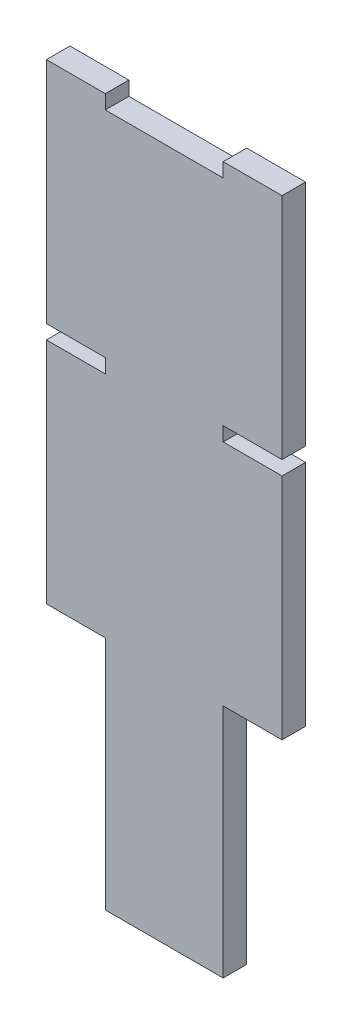
from build123d import *

# Parameters (mm, degrees)
SKETCH2_W           = 50
SKETCH2_H           = 150
BOSS_EXTRUDE1_DEPTH = 5
SKETCH3_W           = 25
SKETCH3_H           = 3
SKETCH3_W_2         = 12.5
SKETCH3_H_2         = 50
CUT_EXTRUDE1_DEPTH  = 5


with BuildPart() as part:
    # Sketch2 → Boss-Extrude1 (new body)
    with BuildSketch(Plane.XY):
        Rectangle(SKETCH2_W, SKETCH2_H)
    extrude(amount=BOSS_EXTRUDE1_DEPTH)

    # Sketch3 → Cut-Extrude1 (cut)
    with BuildSketch(Plane.XY.offset(5)):
        with Locations((0, 73.5)):
            Rectangle(SKETCH3_W, SKETCH3_H)
        with Locations((-18.75, 25)):
            Rectangle(SKETCH3_W_2, SKETCH3_H)
        with Locations((18.75, 25)):
            Rectangle(SKETCH3_W_2, SKETCH3_H)
        with Locations((18.75, -50)):
            Rectangle(SKETCH3_W_2, SKETCH3_H_2)
        with Locations((-18.75, -50)):
            Rectangle(SKETCH3_W_2, SKETCH3_H_2)
    extrude(amount=-CUT_EXTRUDE1_DEPTH, mode=Mode.SUBTRACT)


solid = part.part
